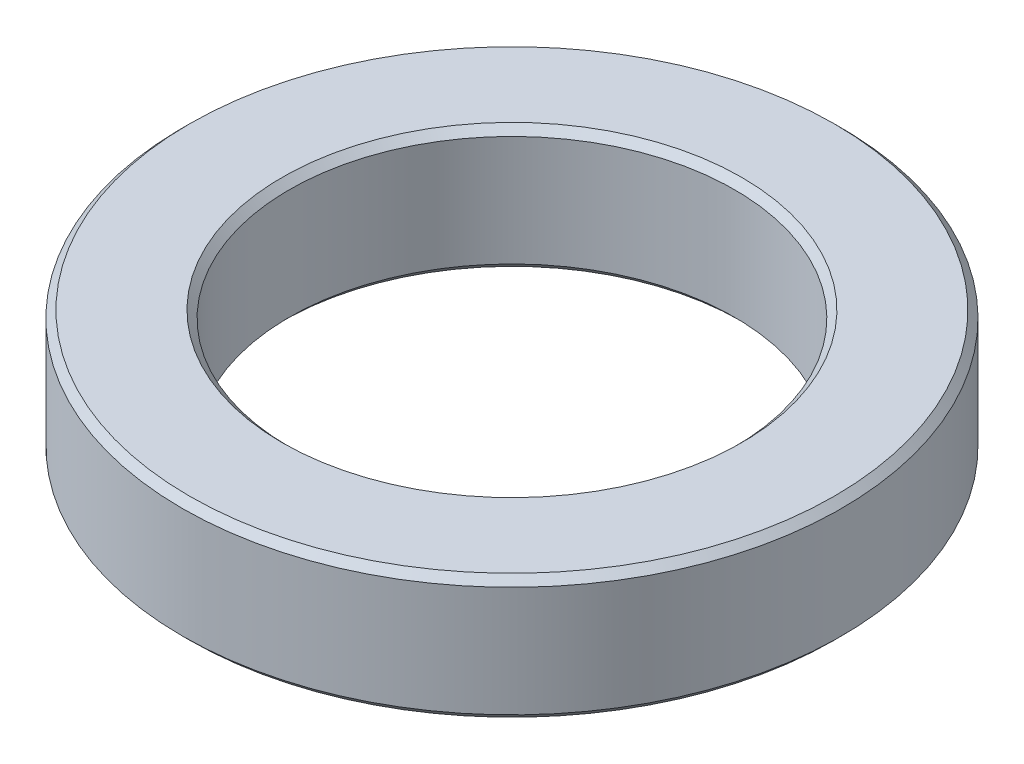
from build123d import *

# Parameters (mm, degrees)
SKETCH1_R           = 18.5
SKETCH1_R_2         = 12.5
BOSS_EXTRUDE1_DEPTH = 7
CHAMFER1_SIZE       = 0.4


with BuildPart() as part:
    # Sketch1 → Boss-Extrude1 (new body)
    with BuildSketch(Plane(origin=(0, 0, 0), x_dir=(1, 0, 0), z_dir=(0, 1, 0))):
        with Locations(Location((0, 0, 0), (0, 0, 270))):
            Circle(SKETCH1_R)
        with Locations(Location((0, 0, 0), (0, 0, 270))):
            Circle(SKETCH1_R_2, mode=Mode.SUBTRACT)
    extrude(amount=BOSS_EXTRUDE1_DEPTH)

    # Chamfer1
    chamfer1_edges = [part.edges().sort_by_distance(p)[0] for p in [
        (0, 0, -18.5),
        (0, 7, -18.5),
        (0, 0, -12.5),
        (0, 7, -12.5),
    ]]
    chamfer(chamfer1_edges, length=CHAMFER1_SIZE)


solid = part.part
